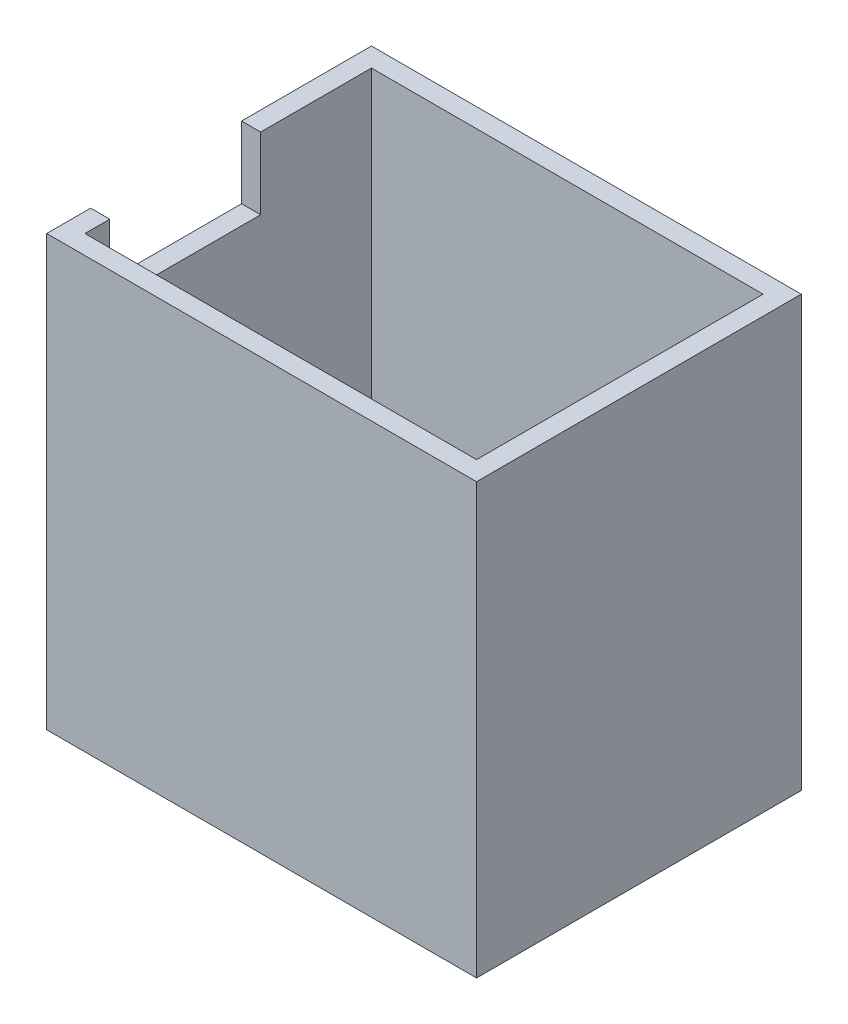
from build123d import *

# Parameters (mm, degrees)
SKETCH1_W                                      = 57.15
SKETCH1_H                                      = 43.18
BASE_DEPTH                                     = 57.15
SKETCH2_W                                      = 52.07
SKETCH2_H                                      = 38.1
POCKET_DEPTH                                   = 47.9552
SKETCH3_W                                      = 18.288
SKETCH3_H                                      = 15.494
LINACTHOLE_DEPTH                               = 68.44465305
ROLLMOTORHOLE_REACH                            = 85.656
SKETCH4_W                                      = 20.066
SKETCH4_H                                      = 9.525
DVIHOLE_REACH                                  = 69.445
CBORE_FOR_4_SOCKET_HEAD_CAP_SCREW1_D           = 3.2639
CBORE_FOR_4_SOCKET_HEAD_CAP_SCREW1_CBORE_D     = 5.55752
CBORE_FOR_4_SOCKET_HEAD_CAP_SCREW1_CBORE_DEPTH = 2.8448
CBORE_FOR_8_SOCKET_HEAD_CAP_SCREW1_D           = 4.4958
CBORE_FOR_8_SOCKET_HEAD_CAP_SCREW1_CBORE_D     = 7.9375
CBORE_FOR_8_SOCKET_HEAD_CAP_SCREW1_CBORE_DEPTH = 4.1656
FILLET1_R                                      = 0.254


with BuildPart() as part:
    # Sketch1 → Base (new body)
    with BuildSketch(Plane(origin=(0, 0, 0), x_dir=(1, 0, 0), z_dir=(0, 1, 0))):
        Rectangle(SKETCH1_W, SKETCH1_H)
    extrude(amount=BASE_DEPTH)

    # Sketch2 → Pocket (cut)
    with BuildSketch(Plane(origin=(0, 57.15, 0), x_dir=(1, 0, 0), z_dir=(0, 1, 0))):
        Rectangle(SKETCH2_W, SKETCH2_H)
    extrude(amount=-POCKET_DEPTH, mode=Mode.SUBTRACT)

    # Sketch3 → LinActHole (cut, through all)
    with BuildSketch(Plane(origin=(0, 0, 0), x_dir=(-1, 0, 0), z_dir=(0, -1, 0))):
        with Locations((-1.651, 0)):
            Rectangle(SKETCH3_W, SKETCH3_H)
    extrude(amount=-LINACTHOLE_DEPTH, mode=Mode.SUBTRACT)

    # Sketch4 → RollMotorHole (cut, up to next)
    with BuildSketch(Plane.ZY.offset(28.575), mode=Mode.PRIVATE) as rollmotorhole_sk1:
        with Locations((5.715, 52.3875)):
            Rectangle(SKETCH4_W, SKETCH4_H)
    rollmotorhole_tool1 = extrude(rollmotorhole_sk1.sketch, amount=-ROLLMOTORHOLE_REACH, mode=Mode.PRIVATE) & part.part
    add(rollmotorhole_tool1.solids().sort_by_distance((-28.575, 52.3875, 5.715))[0], mode=Mode.SUBTRACT)

    # Sketch5 → DviHole (cut, up to next)
    with BuildSketch(Plane.XZ, mode=Mode.PRIVATE) as dvihole_sk1:
        with BuildLine():
            Line((17.624947543, -13.716), (24.228947543, -13.716))
            Line((24.228947543, -13.716), (24.228947543, 13.716))
            Line((24.228947543, 13.716), (17.624947543, 13.716))
            ThreePointArc((17.624947543, 13.716), (15.828896319, 12.972051224), (15.084947543, 11.176))
            Line((15.084947543, 11.176), (15.084947543, -11.176))
            ThreePointArc((15.084947543, -11.176), (15.828896319, -12.972051224), (17.624947543, -13.716))
        make_face()
    dvihole_tool1 = extrude(dvihole_sk1.sketch, amount=-DVIHOLE_REACH, mode=Mode.PRIVATE) & part.part
    add(dvihole_tool1.solids().sort_by_distance((19.701649, 0, 0))[0], mode=Mode.SUBTRACT)

    # CBORE for #4 Socket Head Cap Screw1 (through all)
    with Locations(Plane(origin=(0, 0, 0), x_dir=(-1, 0, 0), z_dir=(0, -1, 0))):
        with Locations((-19.656947543, 16.256), (-19.656947543, -16.256)):
            CounterBoreHole(CBORE_FOR_4_SOCKET_HEAD_CAP_SCREW1_D / 2, CBORE_FOR_4_SOCKET_HEAD_CAP_SCREW1_CBORE_D / 2, CBORE_FOR_4_SOCKET_HEAD_CAP_SCREW1_CBORE_DEPTH)

    # CBORE for #8 Socket Head Cap Screw1 (through all)
    with Locations(Plane(origin=(0, 0, 0), x_dir=(-1, 0, 0), z_dir=(0, -1, 0))):
        with Locations((3.175, 14.605), (3.175, -14.605)):
            CounterBoreHole(CBORE_FOR_8_SOCKET_HEAD_CAP_SCREW1_D / 2, CBORE_FOR_8_SOCKET_HEAD_CAP_SCREW1_CBORE_D / 2, CBORE_FOR_8_SOCKET_HEAD_CAP_SCREW1_CBORE_DEPTH)

    # Fillet1
    fillet1_edges = [part.edges().sort_by_distance(p)[0] for p in [
        (20.783849108, 1.4224, 13.716),
        (18.530045978, 1.4224, 13.716),
        (18.530045978, 1.4224, -13.716),
        (20.783849108, 1.4224, -13.716),
    ]]
    fillet(fillet1_edges, radius=FILLET1_R)


solid = part.part
